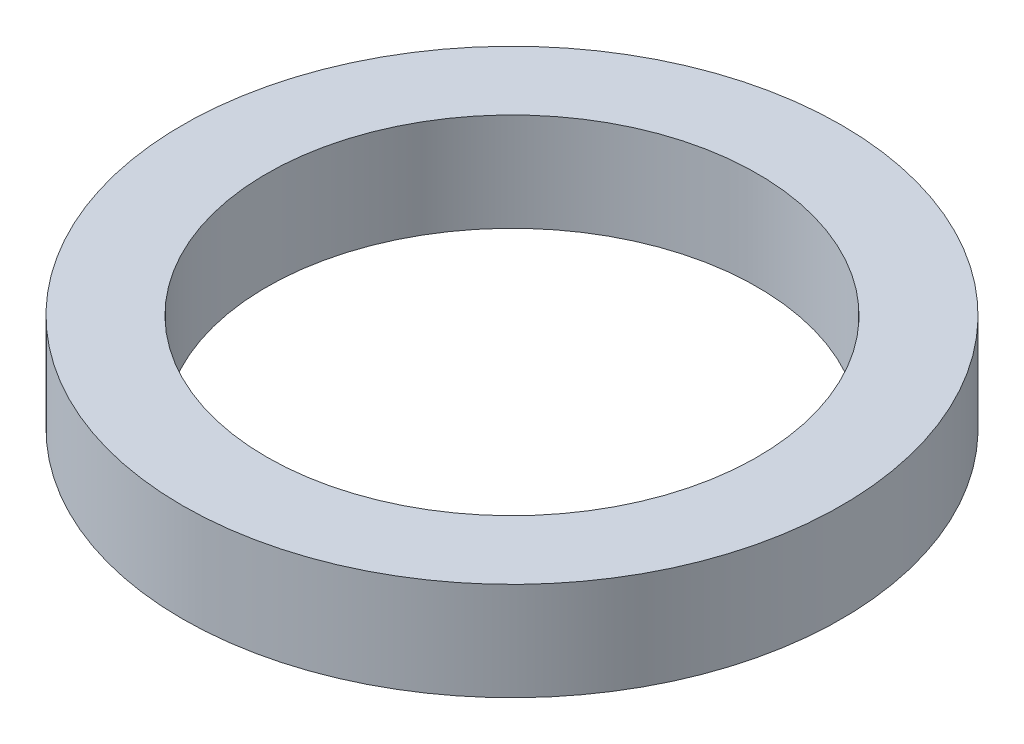
from build123d import *

# Parameters (mm, degrees)
SKETCH_1_R        = 23.5
SKETCH_1_R_2      = 17.5
EXTRUDE_304_DEPTH = 7


with BuildPart() as part:
    # Эскиз1 → Extrude 304 (new body)
    with BuildSketch(Plane(origin=(0, 0, 0), x_dir=(1, 0, 0), z_dir=(0, 1, 0))):
        with Locations(Location((0, 0, 0), (0, 0, 270))):
            Circle(SKETCH_1_R)
        with Locations(Location((0, 0, 0), (0, 0, 270))):
            Circle(SKETCH_1_R_2, mode=Mode.SUBTRACT)
    extrude(amount=EXTRUDE_304_DEPTH)


solid = part.part
